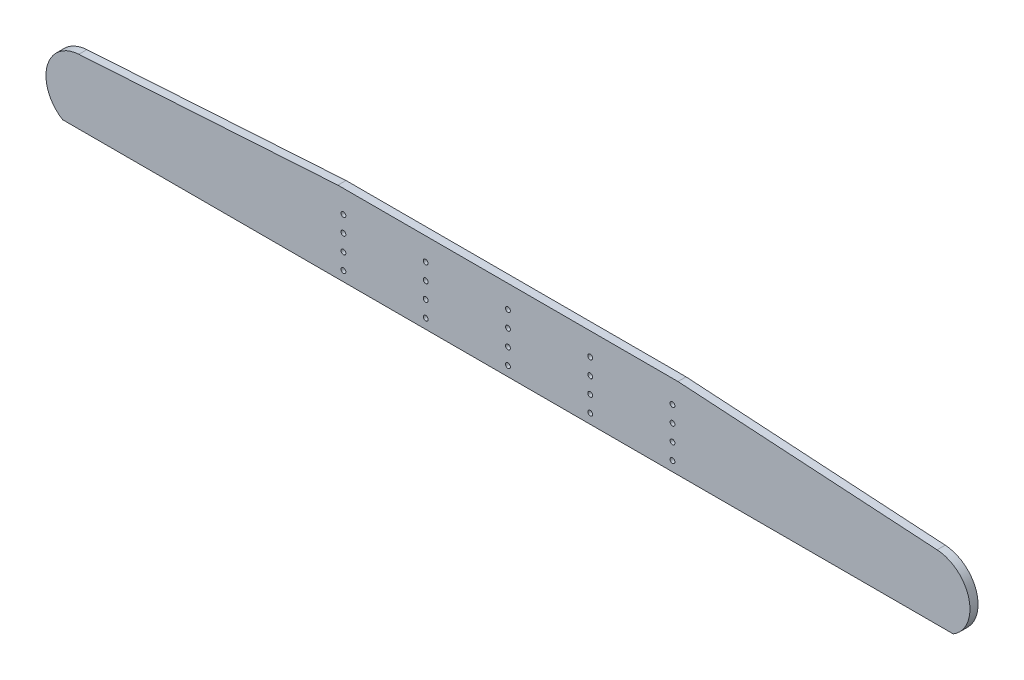
from build123d import *

# Parameters (mm, degrees)
SKETCH3_W           = 210
SKETCH3_H           = 50
BOSS_EXTRUDE1_DEPTH = 5
SKETCH8_R           = 1.5
CUT_EXTRUDE1_DEPTH  = 5


with BuildPart() as part:
    # Sketch3 → Boss-Extrude1 (new body)
    with BuildSketch(Plane.XY):
        Polygon((-265, -25), (-105, -25), (-105, 25), (-265, 15), align=None)
        with BuildLine():
            Line((-275, -25), (-265, -25))
            Line((-265, -25), (-265, 15))
            ThreePointArc((-265, 15), (-284.634416342, -1.341395914), (-275, -25))
        make_face()
        Rectangle(SKETCH3_W, SKETCH3_H)
        Polygon((105, 25), (105, -25), (265, -25), (265, 15), align=None)
        with BuildLine():
            Line((265, 15), (265, -25))
            Line((265, -25), (275, -25))
            ThreePointArc((275, -25), (284.634416342, -1.341395914), (265, 15))
        make_face()
    extrude(amount=BOSS_EXTRUDE1_DEPTH)

    # Sketch8 → Cut-Extrude1 (cut)
    with BuildSketch(Plane.XY.offset(5)):
        with Locations((0, 11)):
            Circle(SKETCH8_R)
        with Locations((0, 1)):
            Circle(SKETCH8_R)
        with Locations((0, -9)):
            Circle(SKETCH8_R)
        with Locations((0, -19)):
            Circle(SKETCH8_R)
        with Locations((50.8, 11)):
            Circle(SKETCH8_R)
        with Locations((50.8, -9)):
            Circle(SKETCH8_R)
        with Locations((50.8, 1)):
            Circle(SKETCH8_R)
        with Locations((50.8, -19)):
            Circle(SKETCH8_R)
        with Locations((101.6, 11)):
            Circle(SKETCH8_R)
        with Locations((101.6, -9)):
            Circle(SKETCH8_R)
        with Locations((101.6, 1)):
            Circle(SKETCH8_R)
        with Locations((101.6, -19)):
            Circle(SKETCH8_R)
        with Locations((-50.8, 11)):
            Circle(SKETCH8_R)
        with Locations((-50.8, 1)):
            Circle(SKETCH8_R)
        with Locations((-50.8, -9)):
            Circle(SKETCH8_R)
        with Locations((-50.8, -19)):
            Circle(SKETCH8_R)
        with Locations((-101.6, 11)):
            Circle(SKETCH8_R)
        with Locations((-101.6, 1)):
            Circle(SKETCH8_R)
        with Locations((-101.6, -9)):
            Circle(SKETCH8_R)
        with Locations((-101.6, -19)):
            Circle(SKETCH8_R)
    extrude(amount=-CUT_EXTRUDE1_DEPTH, mode=Mode.SUBTRACT)


solid = part.part
